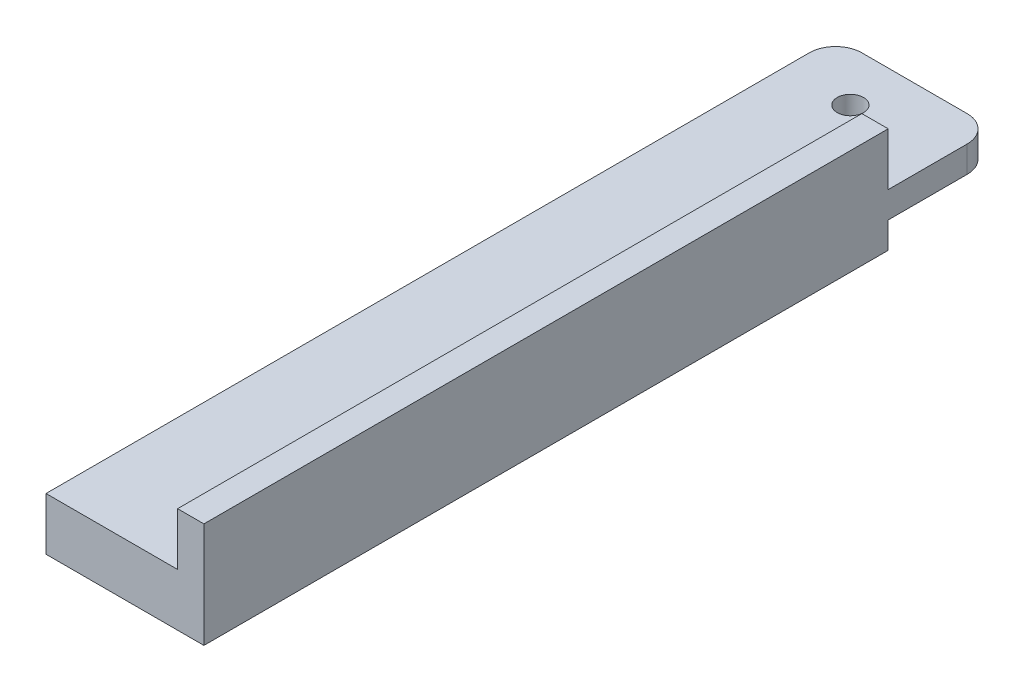
from build123d import *

# Parameters (mm, degrees)
EXTRUDE_1_DEPTH     = 300
SKETCH_2_W          = 10
SKETCH_2_H          = 20
CUT_EXTRUDE_1_DEPTH = 40
SKETCH_4_R          = 5
CUT_EXTRUDE_2_DEPTH = 307.594194335
CUT_EXTRUDE_3_DEPTH = 309.544972411
FILLET_1_R          = 10


with BuildPart() as part:
    # 草图1 → 凸台-拉伸1 (new body)
    with BuildSketch(Plane.XY):
        Polygon((0, 0), (0, -40), (60, -40), (60, -20), (10, -20), (10, 0), align=None)
    extrude_1 = extrude(amount=EXTRUDE_1_DEPTH)

    # 草图2 → 切除-拉伸1 (cut)
    with BuildSketch(Plane(origin=(0, 0, 0), x_dir=(-1, 0, 0), z_dir=(0, 0, -1))):
        with Locations((-5, -10)):
            Rectangle(SKETCH_2_W, SKETCH_2_H)
        Polygon((-10, -30), (0, -30), (0, -40), (-10, -40), (-60, -40), (-60, -30), align=None)
    cut_extrude_1 = extrude(amount=-CUT_EXTRUDE_1_DEPTH, mode=Mode.SUBTRACT)

    # 草图4 → 切除-拉伸2 (cut, symmetric)
    with BuildSketch(Plane(origin=(0, -20, 0), x_dir=(1, 0, 0), z_dir=(0, 1, 0))):
        with Locations(Location((35, -19.364916731, 0), (0, 0, 180))):
            Circle(SKETCH_4_R)
    cut_extrude_2 = extrude(amount=CUT_EXTRUDE_2_DEPTH, both=True, mode=Mode.SUBTRACT)

    # 镜向1: 凸台-拉伸1, 切除-拉伸1, 切除-拉伸2 across plane
    add(extrude_1.mirror(Plane(origin=(0, 0, 300), x_dir=(0, 0, 1), z_dir=(1, 0, 0))))
    add(cut_extrude_1.mirror(Plane(origin=(0, 0, 300), x_dir=(0, 0, 1), z_dir=(1, 0, 0))), mode=Mode.SUBTRACT)
    add(cut_extrude_2.mirror(Plane(origin=(0, 0, 300), x_dir=(0, 0, 1), z_dir=(1, 0, 0))), mode=Mode.SUBTRACT)

    # 草图6 → 切除-拉伸3 (cut, through all)
    with BuildSketch(Plane(origin=(0, 0, 0), x_dir=(1, 0, 0), z_dir=(0, 1, 0))):
        Polygon((0, -314.936962627), (157.439827962, -317.852514996), (163.764973114, 23.705323245), (0, 26.738007932), align=None)
    extrude(amount=-CUT_EXTRUDE_3_DEPTH, mode=Mode.SUBTRACT)

    # 圆角1
    fillet_1_edges = [part.edges().sort_by_distance(p)[0] for p in [
        (0, -25, 0),
        (-60, -25, 0),
    ]]
    fillet(fillet_1_edges, radius=FILLET_1_R)


solid = part.part
